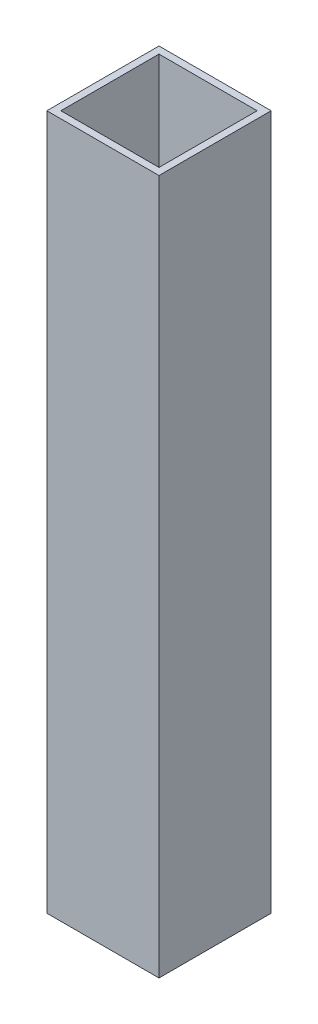
from build123d import *

# Parameters (mm, degrees)
SKETCH1_W           = 50.8
SKETCH1_H           = 50.8
SKETCH1_W_2         = 44.45
SKETCH1_H_2         = 44.45
BOSS_EXTRUDE1_DEPTH = 314.8076


with BuildPart() as part:
    # Sketch1 → Boss-Extrude1 (new body)
    with BuildSketch(Plane(origin=(0, 0, 0), x_dir=(1, 0, 0), z_dir=(0, 1, 0))):
        Rectangle(SKETCH1_W, SKETCH1_H)
        Rectangle(SKETCH1_W_2, SKETCH1_H_2, mode=Mode.SUBTRACT)
    extrude(amount=BOSS_EXTRUDE1_DEPTH)


solid = part.part
